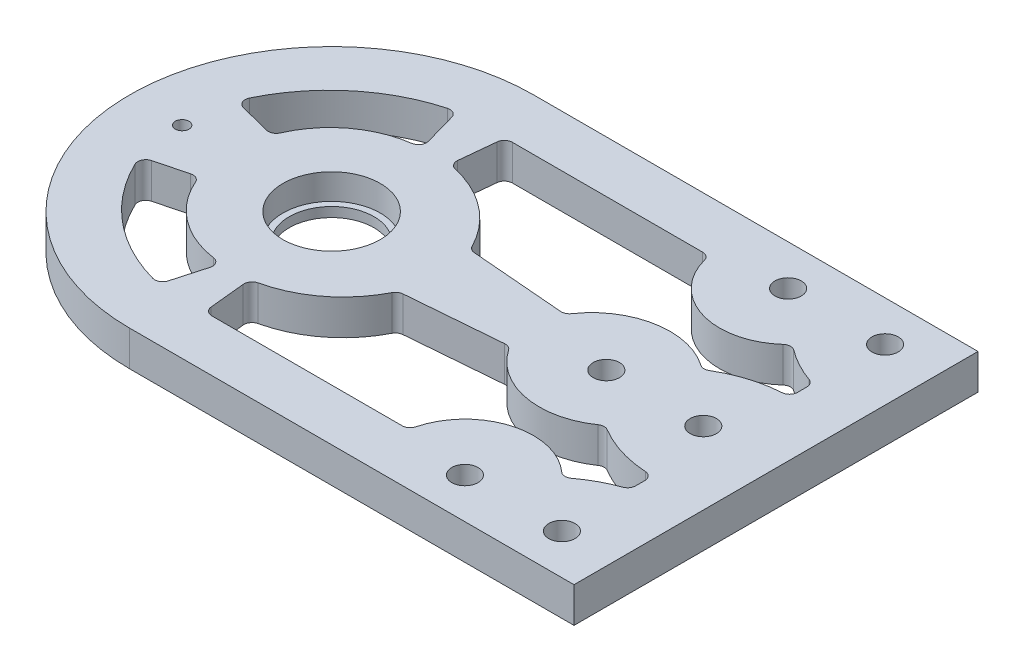
from build123d import *

# Parameters (mm, degrees)
SKETCH1_R           = 3.25
SKETCH1_R_2         = 10.5
BOSS_EXTRUDE1_DEPTH = 8.73125
SKETCH2_R           = 12.05
CUT_EXTRUDE1_DEPTH  = 6.35
SKETCH6_R           = 1.7
CUT_EXTRUDE4_DEPTH  = 189.881536225
FILLET1_R           = 2


with BuildPart() as part:
    # Sketch1 → Boss-Extrude1 (new body)
    with BuildSketch(Plane(origin=(0, 0, 0), x_dir=(1, 0, 0), z_dir=(0, 1, 0))):
        with BuildLine():
            Line((-110, -100), (0, -100))
            Line((0, -100), (0, 0))
            Line((0, 0), (-110, 0))
            ThreePointArc((-110, 0), (-160, -50), (-110, -100))
        make_face()
        with Locations(Location((-13, -10, 0), (0, 0, 270))):
            Circle(SKETCH1_R, mode=Mode.SUBTRACT)
        with Locations(Location((-37, -10, 0), (0, 0, 270))):
            Circle(SKETCH1_R, mode=Mode.SUBTRACT)
        with Locations(Location((-18, -50, 0), (0, 0, 270))):
            Circle(SKETCH1_R, mode=Mode.SUBTRACT)
        with Locations(Location((-13, -90, 0), (0, 0, 270))):
            Circle(SKETCH1_R, mode=Mode.SUBTRACT)
        with Locations(Location((-37, -90, 0), (0, 0, 270))):
            Circle(SKETCH1_R, mode=Mode.SUBTRACT)
        with Locations(Location((-42, -50, 0), (0, 0, 270))):
            Circle(SKETCH1_R, mode=Mode.SUBTRACT)
        with Locations(Location((-110, -50, 0), (0, 0, 270))):
            Circle(SKETCH1_R_2, mode=Mode.SUBTRACT)
    extrude(amount=BOSS_EXTRUDE1_DEPTH)

    # Sketch2 → Cut-Extrude1 (cut)
    with BuildSketch(Plane(origin=(0, 8.73125, 0), x_dir=(1, 0, 0), z_dir=(0, 1, 0))):
        with Locations(Location((-110, -50, 0), (0, 0, 270))):
            Circle(SKETCH2_R)
    extrude(amount=-CUT_EXTRUDE1_DEPTH, mode=Mode.SUBTRACT)

    # Sketch6 → Cut-Extrude4 (cut, through all)
    with BuildSketch(Plane(origin=(0, 8.73125, 0), x_dir=(1, 0, 0), z_dir=(0, 1, 0))):
        with Locations(Location((-147, -50, 0), (0, 0, 270))):
            Circle(SKETCH6_R)
        with BuildLine():
            Line((-133.793921789, -41.071004616), (-145.477766874, -38.051775556))
            ThreePointArc((-145.477766874, -38.051775556), (-133.72851482, -21.93564785), (-115.86984126, -13.056330604))
            Line((-115.86984126, -13.056330604), (-112.417796121, -25.271259557))
            ThreePointArc((-112.417796121, -25.271259557), (-125.525564083, -29.897413384), (-133.793921789, -41.071004616))
        make_face()
        with BuildLine():
            Line((-105.513705843, -25.271259557), (-104.258758681, -12.795366162))
            Line((-104.258758681, -12.795366162), (-53.734606151, -12.795366162))
            ThreePointArc((-53.734606151, -12.795366162), (-41.801024618, -26.273023002), (-24.46272378, -21.431439979))
            ThreePointArc((-24.46272378, -21.431439979), (-19.304766449, -24.941567185), (-13.556215286, -27.366371581))
            Line((-13.556215286, -27.366371581), (-13.556215286, -33.028900538))
            ThreePointArc((-13.556215286, -33.028900538), (-22.279595055, -34.31177696), (-30.264301501, -38.051775556))
            ThreePointArc((-30.264301501, -38.051775556), (-45.81064331, -34.0967888), (-59.032653211, -43.180241783))
            Line((-59.032653211, -43.180241783), (-84.662721734, -41.071004616))
            ThreePointArc((-84.662721734, -41.071004616), (-93.117084888, -30.569825722), (-105.513705843, -25.271259557))
        make_face()
        with BuildLine():
            Line((-115.86984126, -86.943669396), (-112.417796121, -74.728740443))
            ThreePointArc((-112.417796121, -74.728740443), (-125.525564083, -70.102586616), (-133.793921789, -58.928995384))
            Line((-133.793921789, -58.928995384), (-145.477766874, -61.948224444))
            ThreePointArc((-145.477766874, -61.948224444), (-133.72851482, -78.06435215), (-115.86984126, -86.943669396))
        make_face()
        with BuildLine():
            Line((-104.258758681, -87.204633838), (-53.734606151, -87.204633838))
            ThreePointArc((-53.734606151, -87.204633838), (-41.801024618, -73.726976998), (-24.46272378, -78.568560021))
            ThreePointArc((-24.46272378, -78.568560021), (-19.304766449, -75.058432815), (-13.556215286, -72.633628419))
            Line((-13.556215286, -72.633628419), (-13.556215286, -66.971099462))
            ThreePointArc((-13.556215286, -66.971099462), (-22.279595055, -65.68822304), (-30.264301501, -61.948224444))
            ThreePointArc((-30.264301501, -61.948224444), (-45.81064331, -65.9032112), (-59.032653211, -56.819758217))
            Line((-59.032653211, -56.819758217), (-84.662721734, -58.928995384))
            ThreePointArc((-84.662721734, -58.928995384), (-93.117084888, -69.430174278), (-105.513705843, -74.728740443))
            Line((-105.513705843, -74.728740443), (-104.258758681, -87.204633838))
        make_face()
    extrude(amount=-CUT_EXTRUDE4_DEPTH, mode=Mode.SUBTRACT)

    # Fillet1
    fillet1_edges = [part.edges().sort_by_distance(p)[0] for p in [
        (-13.556215286, 4.365625, 33.028900538),
        (-30.264301501, 4.365625, 38.051775556),
        (-59.032653211, 4.365625, 43.180241783),
        (-112.417796121, 4.365625, 25.271259557),
        (-133.793921789, 4.365625, 41.071004616),
        (-145.477766874, 4.365625, 38.051775556),
        (-115.86984126, 4.365625, 13.056330604),
        (-24.46272378, 4.365625, 78.568560021),
        (-53.734606151, 4.365625, 87.204633838),
        (-104.258758681, 4.365625, 87.204633838),
        (-105.513705843, 4.365625, 74.728740443),
        (-84.662721734, 4.365625, 58.928995384),
        (-59.032653211, 4.365625, 56.819758217),
        (-30.264301501, 4.365625, 61.948224444),
        (-13.556215286, 4.365625, 66.971099462),
        (-13.556215286, 4.365625, 72.633628419),
        (-115.86984126, 4.365625, 86.943669396),
        (-145.477766874, 4.365625, 61.948224444),
        (-133.793921789, 4.365625, 58.928995384),
        (-112.417796121, 4.365625, 74.728740443),
        (-84.662721734, 4.365625, 41.071004616),
        (-105.513705843, 4.365625, 25.271259557),
        (-104.258758681, 4.365625, 12.795366162),
        (-53.734606151, 4.365625, 12.795366162),
        (-24.46272378, 4.365625, 21.431439979),
        (-13.556215286, 4.365625, 27.366371581),
    ]]
    fillet(fillet1_edges, radius=FILLET1_R)


solid = part.part
